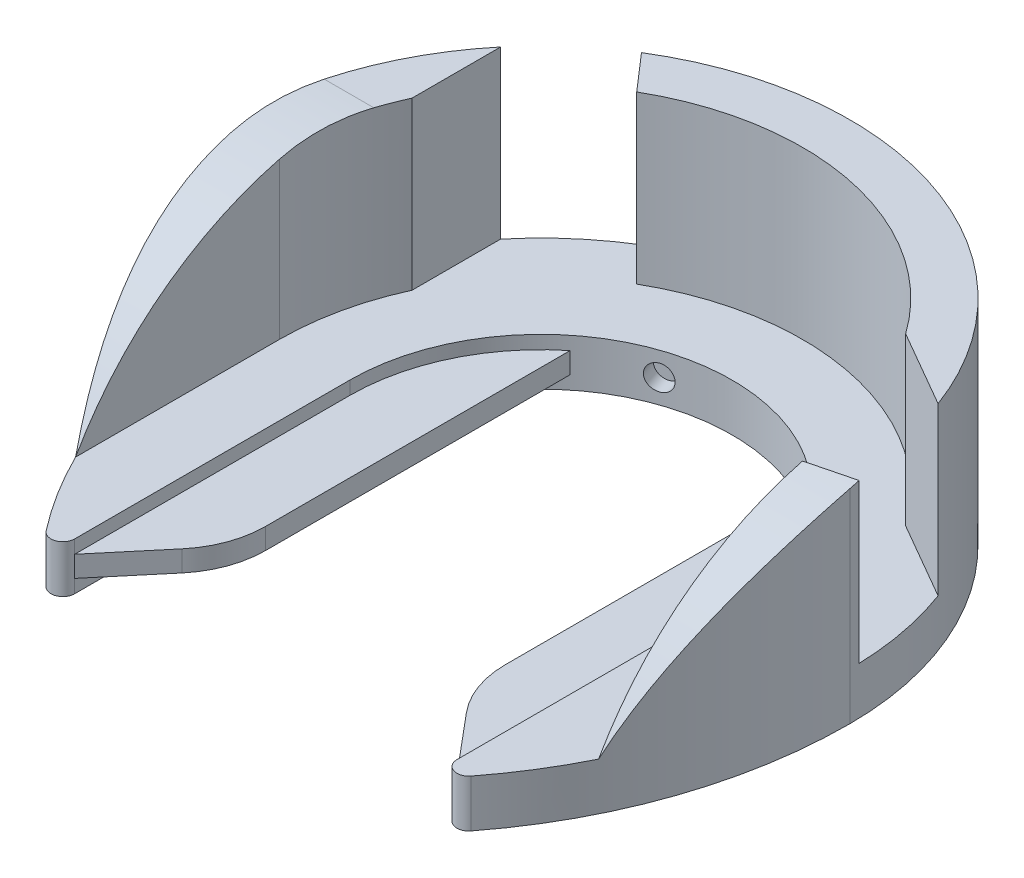
from build123d import *

# Parameters (mm, degrees)
BOSS_EXTRUDE1_DEPTH     = 10
BOSS_EXTRUDE2_START     = 2.8
BOSS_EXTRUDE2_DEPTH     = 4.4
BOSS_EXTRUDE3_DEPTH     = 45
CUT_EXTRUDE1_DEPTH      = 103.347447452
CUT_EXTRUDE1_DEPTH_BACK = 103.347447452
CUT_EXTRUDE2_START      = -35
CUT_EXTRUDE2_DEPTH      = 35
SKETCH7_R               = 2.625
CUT_EXTRUDE5_DEPTH      = 43.5


with BuildPart() as part:
    # Sketch1 → Boss-Extrude1 (new body)
    with BuildSketch(Plane(origin=(0, 0, 0), x_dir=(1, 0, 0), z_dir=(0, 1, 0))):
        with BuildLine():
            Line((-40.2, -57.876303889), (-40.2, 0))
            ThreePointArc((-40.2, 0), (-36.256585609, 17.363755354), (-25.2, 31.320919527))
            ThreePointArc((-25.2, 31.320919527), (0, 40.2), (25.2, 31.320919527))
            ThreePointArc((25.2, 31.320919527), (36.256585609, 17.363755354), (40.2, 0))
            Line((40.2, 0), (40.2, -57.876303889))
            ThreePointArc((40.2, -57.876303889), (41.890773052, -60.2417112), (44.676121397, -59.40762496))
            ThreePointArc((44.676121397, -59.40762496), (50.25367708, -51.409776352), (55, -42.892316139))
            Line((55, -42.892316139), (55, 0))
            ThreePointArc((55, 0), (0, 55), (-55, 0))
            Line((-55, 0), (-55, -42.892316139))
            ThreePointArc((-55, -42.892316139), (-50.25367708, -51.409776352), (-44.676121397, -59.40762496))
            ThreePointArc((-44.676121397, -59.40762496), (-41.890773052, -60.2417112), (-40.2, -57.876303889))
        make_face()
    extrude(amount=BOSS_EXTRUDE1_DEPTH)

    # Sketch1<5> → Boss-Extrude2 (add)
    with BuildSketch(Plane(origin=(0, 0, 0), x_dir=(1, 0, 0), z_dir=(0, 1, 0)).offset(BOSS_EXTRUDE2_START)):
        with BuildLine():
            ThreePointArc((-25.2, 31.320919527), (-36.256585609, 17.363755354), (-40.2, 0))
            Line((-40.2, 0), (-40.2, -57.876303889))
            Line((-40.2, -57.876303889), (-29.879111138, -45.576347508))
            ThreePointArc((-29.879111138, -45.576347508), (-26.406147584, -39.560998181), (-25.2, -32.720595315))
            Line((-25.2, -32.720595315), (-25.2, 31.320919527))
        make_face()
        with BuildLine():
            ThreePointArc((40.2, 0), (36.256585609, 17.363755354), (25.2, 31.320919527))
            Line((25.2, 31.320919527), (25.2, -32.720595315))
            ThreePointArc((25.2, -32.720595315), (26.406147584, -39.560998181), (29.879111138, -45.576347508))
            Line((29.879111138, -45.576347508), (40.2, -57.876303889))
            Line((40.2, -57.876303889), (40.2, 0))
        make_face()
    extrude(amount=BOSS_EXTRUDE2_DEPTH)

    # Sketch1<6> → Boss-Extrude3 (add)
    with BuildSketch(Plane(origin=(0, 0, 0), x_dir=(1, 0, 0), z_dir=(0, 1, 0))):
        with BuildLine():
            ThreePointArc((-65, 0), (-62.466921066, -22.021300959), (-55, -42.892316139))
            Line((-55, -42.892316139), (-55, 0))
            ThreePointArc((-55, 0), (0, 55), (55, 0))
            Line((55, 0), (55, -42.892316139))
            ThreePointArc((55, -42.892316139), (62.466921066, -22.021300959), (65, 0))
            ThreePointArc((65, 0), (0, 65), (-65, 0))
        make_face()
    extrude(amount=BOSS_EXTRUDE3_DEPTH)

    # Sketch2 → Cut-Extrude1 (cut, two sides: drawn at the far end of the back side and taken through both)
    with BuildSketch(Plane(origin=(0, 0, 0), x_dir=(0, 0, -1), z_dir=(1, 0, 0)).offset(-CUT_EXTRUDE1_DEPTH_BACK)):
        with BuildLine():
            Line((-42.892316139, 10), (-42.892316139, 45))
            Line((-42.892316139, 45), (17.107683861, 45))
            ThreePointArc((17.107683861, 45), (-17.623426113, 35.61047424), (-42.892316139, 10))
        make_face()
    extrude(amount=CUT_EXTRUDE1_DEPTH + CUT_EXTRUDE1_DEPTH_BACK, mode=Mode.SUBTRACT)

    # Sketch3 → Cut-Extrude2 (cut)
    with BuildSketch(Plane(origin=(0, 45, 0), x_dir=(1, 0, 0), z_dir=(0, 1, 0)).offset(CUT_EXTRUDE2_START)):
        with BuildLine():
            Line((-34.164958741, 55.296976357), (-27.5, 47.631397208))
            ThreePointArc((-27.5, 47.631397208), (-36.087479082, 41.505347288), (-43.347496237, 33.852541558))
            ThreePointArc((-43.347496237, 33.852541558), (-47.000937608, 28.564170983), (-50.012454978, 22.885679957))
            Line((-50.012454978, 22.885679957), (-50.012454978, 41.518120707))
            ThreePointArc((-50.012454978, 41.518120707), (-42.648838916, 49.051774067), (-34.164958741, 55.296976357))
        make_face()
        with BuildLine():
            Line((64.971065648, 1.93923401), (55, 0))
            ThreePointArc((55, 0), (53.988424685, 10.5), (50.990909091, 20.613762153))
            ThreePointArc((50.990909091, 20.613762153), (48.237766513, 26.421920479), (44.825807714, 31.869216538))
            Line((44.825807714, 31.869216538), (60.961974739, 22.552996163))
            ThreePointArc((60.961974739, 22.552996163), (63.804501901, 12.409090909), (64.971065648, 1.93923401))
        make_face()
    extrude(amount=CUT_EXTRUDE2_DEPTH, mode=Mode.SUBTRACT)

    # Sketch7 → Cut-Extrude5 (cut)
    with BuildSketch(Plane(origin=(0, 0, 0), x_dir=(0, 1, 0), z_dir=(0.32556815445715737, 0, 0.9455185755993166))):
        with Locations(Location((5, 0, 0), (0, 0, 270))):
            Circle(SKETCH7_R)
    extrude(amount=-CUT_EXTRUDE5_DEPTH, mode=Mode.SUBTRACT)


solid = part.part
